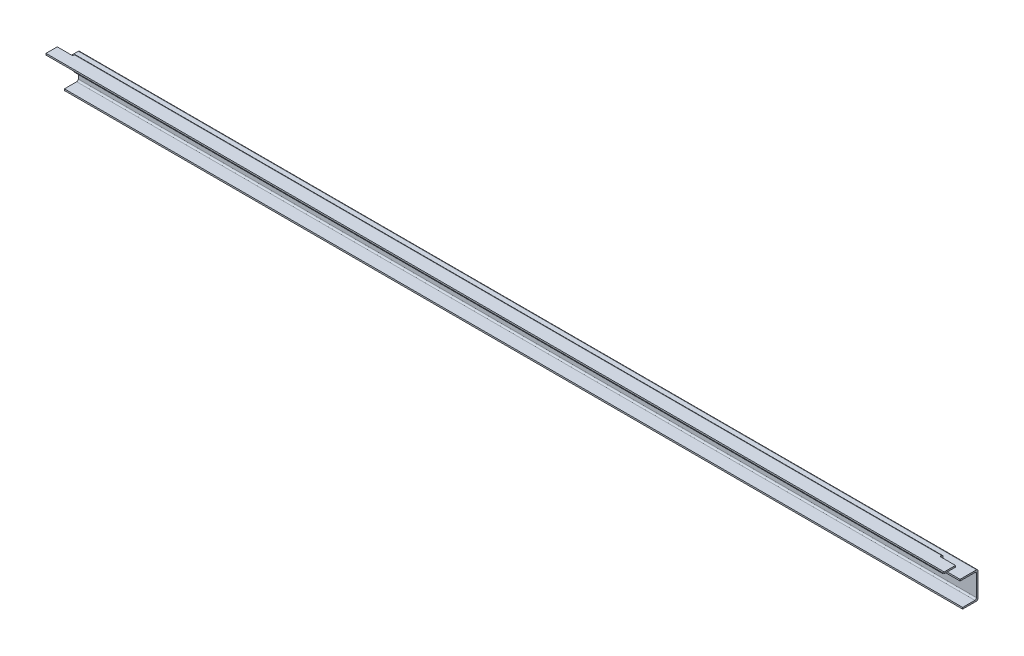
from build123d import *

# Parameters (mm, degrees)
BOSS_EXTRUDE1_DEPTH     = 1754
FILLET2_R               = 3
CUT_EXTRUDE4_DEPTH      = 3
CUT_EXTRUDE4_DEPTH_BACK = 6
SKETCH8_W               = 30
SKETCH8_H               = 31


with BuildPart() as part:
    # Sketch3 → Boss-Extrude1 (new body)
    with BuildSketch(Plane(origin=(0, 0, 0), x_dir=(0, 0, -1), z_dir=(1, 0, 0))):
        Polygon((0, 0), (28, 0), (28, -28), (66, -28), (66, -81), (36, -81), (36, -78), (63, -78), (63, -31), (25, -31), (25, -3), (0, -3), align=None)
    extrude(amount=BOSS_EXTRUDE1_DEPTH)

    # Fillet2
    fillet2_edges = [part.edges().sort_by_distance(p)[0] for p in [
        (877, 0, -28),
        (877, -28, -28),
        (877, -28, -66),
        (877, -81, -66),
        (877, -78, -63),
        (877, -31, -63),
        (877, -31, -25),
        (877, -3, -25),
    ]]
    fillet(fillet2_edges, radius=FILLET2_R)

    # Sketch8 → Cut-Extrude4 (cut, two sides: drawn at the far end of the back side and taken through both)
    with BuildSketch(Plane(origin=(0, 0, -28), x_dir=(-1, 0, 0), z_dir=(0, 0, -1)).offset(-CUT_EXTRUDE4_DEPTH_BACK)):
        with Locations((-15, -15.5)):
            Rectangle(SKETCH8_W, SKETCH8_H)
        with Locations((-1739, -15.5)):
            Rectangle(SKETCH8_W, SKETCH8_H)
    extrude(amount=CUT_EXTRUDE4_DEPTH + CUT_EXTRUDE4_DEPTH_BACK, mode=Mode.SUBTRACT)


solid = part.part
